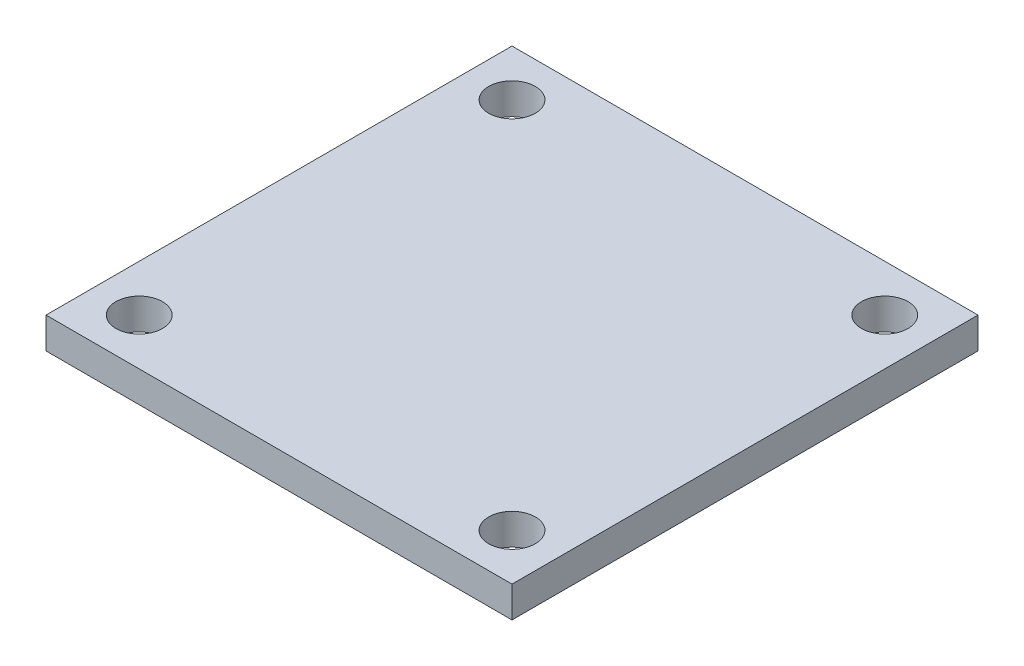
from build123d import *

# Parameters (mm, degrees)
SKETCH1_W           = 30
SKETCH1_H           = 30
SKETCH1_R           = 1.5
BOSS_EXTRUDE1_DEPTH = 2


with BuildPart() as part:
    # Sketch1 → Boss-Extrude1 (new body)
    with BuildSketch(Plane(origin=(0, 0, 0), x_dir=(1, 0, 0), z_dir=(0, 1, 0))):
        Rectangle(SKETCH1_W, SKETCH1_H)
        with Locations(Location((-12, 12, 0), (0, 0, 270))):
            Circle(SKETCH1_R, mode=Mode.SUBTRACT)
        with Locations(Location((12, 12, 0), (0, 0, 90))):
            Circle(SKETCH1_R, mode=Mode.SUBTRACT)
        with Locations(Location((12, -12, 0), (0, 0, 270))):
            Circle(SKETCH1_R, mode=Mode.SUBTRACT)
        with Locations(Location((-12, -12, 0), (0, 0, 90))):
            Circle(SKETCH1_R, mode=Mode.SUBTRACT)
    extrude(amount=BOSS_EXTRUDE1_DEPTH)


solid = part.part
